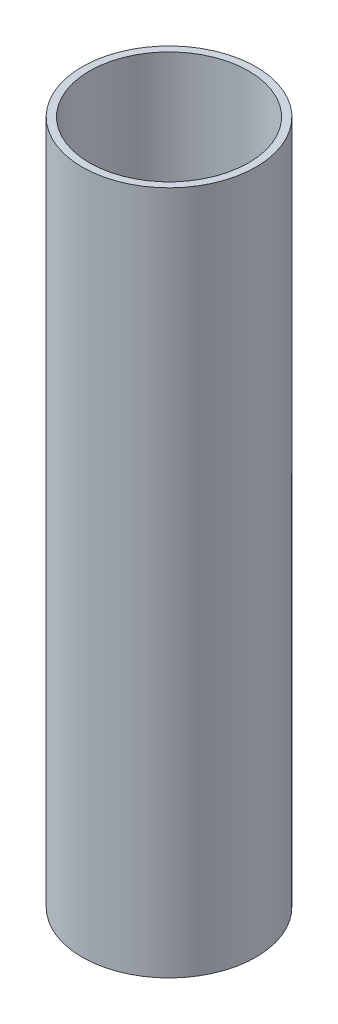
from build123d import *

# Parameters (mm, degrees)
SKETCH1_R           = 19.05
SKETCH1_R_2         = 17.45
BOSS_EXTRUDE1_DEPTH = 150


with BuildPart() as part:
    # Sketch1 → Boss-Extrude1 (new body)
    with BuildSketch(Plane(origin=(0, 0, 0), x_dir=(1, 0, 0), z_dir=(0, 1, 0))):
        with Locations(Location((0, 0, 0), (0, 0, 270))):
            Circle(SKETCH1_R)
        with Locations(Location((0, 0, 0), (0, 0, 270))):
            Circle(SKETCH1_R_2, mode=Mode.SUBTRACT)
    extrude(amount=BOSS_EXTRUDE1_DEPTH)


solid = part.part
